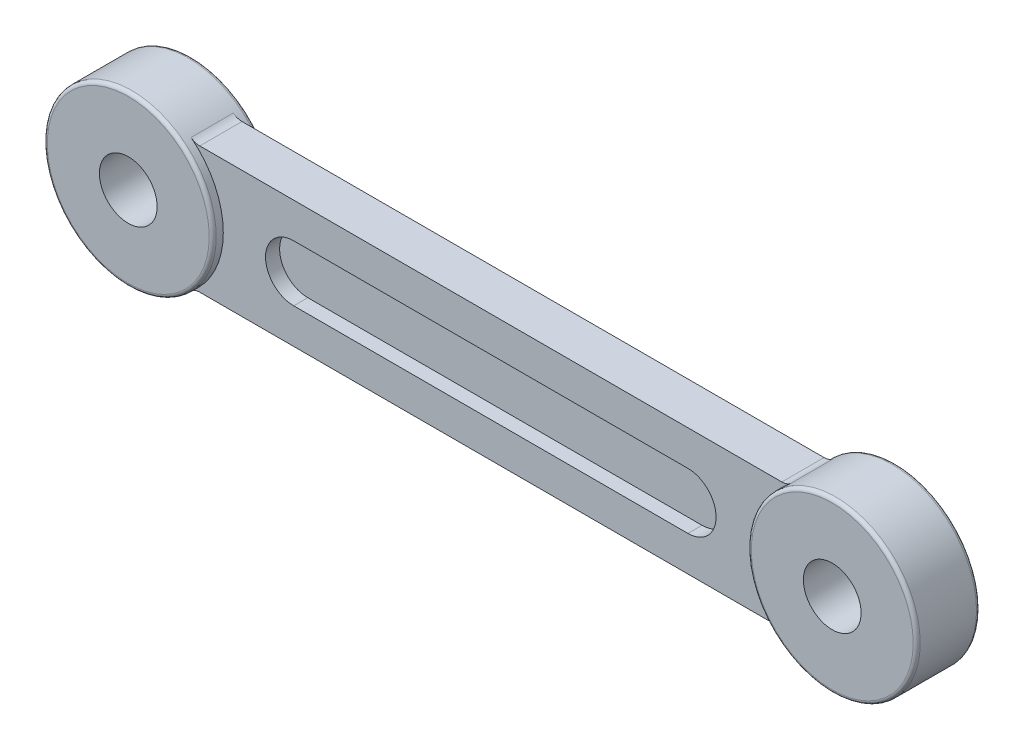
from build123d import *

# Parameters (mm, degrees)
EXTRUDE_1_DEPTH      = 3
EXTRUDE_1_DEPTH_BACK = 3
EXTRUDE_2_DEPTH      = 4.5
EXTRUDE_2_DEPTH_BACK = 4.5
SKETCH_1_3_R         = 12
SKETCH_1_3_R_2       = 4.1
FILLET_1_R           = 2
FILLET_2_R           = 0.5
CUT_EXTRUDE_1_DEPTH  = 2


with BuildPart() as part:
    # 草图1 → 凸台-拉伸1 (new, two sides: drawn at the far end of the back side and taken through both)
    with BuildSketch(Plane.XY.offset(-EXTRUDE_1_DEPTH_BACK)):
        with BuildLine():
            Line((42.062746067, 9), (-42.062746067, 9))
            ThreePointArc((-42.062746067, 9), (-39.062746067, 4.937253933), (-38, 0))
            ThreePointArc((-38, 0), (-39.062746067, -4.937253933), (-42.062746067, -9))
            Line((-42.062746067, -9), (42.062746067, -9))
            ThreePointArc((42.062746067, -9), (38, 0), (42.062746067, 9))
        make_face()
    extrude(amount=EXTRUDE_1_DEPTH + EXTRUDE_1_DEPTH_BACK)

    # 草图1<3> → 凸台-拉伸2 (add, two sides: drawn at the far end of the back side and taken through both)
    # profile 1 of 2: a face of its own
    with BuildSketch(Plane.XY.offset(-EXTRUDE_2_DEPTH_BACK)):
        with Locations((-50, 0)):
            Circle(SKETCH_1_3_R)
        with Locations((-50, 0)):
            Circle(SKETCH_1_3_R_2, mode=Mode.SUBTRACT)
    # profile 2 of 2: a face of its own
    with BuildSketch(Plane.XY.offset(-EXTRUDE_2_DEPTH_BACK)):
        with Locations((50, 0)):
            Circle(SKETCH_1_3_R)
        with Locations((50, 0)):
            Circle(SKETCH_1_3_R_2, mode=Mode.SUBTRACT)
    extrude(amount=EXTRUDE_2_DEPTH + EXTRUDE_2_DEPTH_BACK)

    # 圆角1
    fillet_1_edges = [part.edges().sort_by_distance(p)[0] for p in [
        (42.062746067, 9, -1.5),
        (-42.062746067, 9, -1.5),
        (42.062746067, -9, -1.5),
        (-42.062746067, -9, -1.5),
    ]]
    fillet(fillet_1_edges, radius=FILLET_1_R)

    # 圆角2
    fillet_2_edges = [part.edges().sort_by_distance(p)[0] for p in [
        (38, 0, -4.5),
        (-62, 0, -4.5),
        (38, 0, 4.5),
        (-62, 0, 4.5),
    ]]
    fillet(fillet_2_edges, radius=FILLET_2_R)

    # 草图2 → 切除-拉伸1 (cut)
    with BuildSketch(Plane.XY.offset(3)):
        with BuildLine():
            Line((-28, 4), (28, 4))
            ThreePointArc((28, 4), (32, 0), (28, -4))
            Line((28, -4), (-28, -4))
            ThreePointArc((-28, -4), (-32, 0), (-28, 4))
        make_face()
    cut_extrude_1 = extrude(amount=-CUT_EXTRUDE_1_DEPTH, mode=Mode.SUBTRACT)

    # 镜向1: 切除-拉伸1 across plane
    add(cut_extrude_1.mirror(Plane.XY), mode=Mode.SUBTRACT)


solid = part.part
